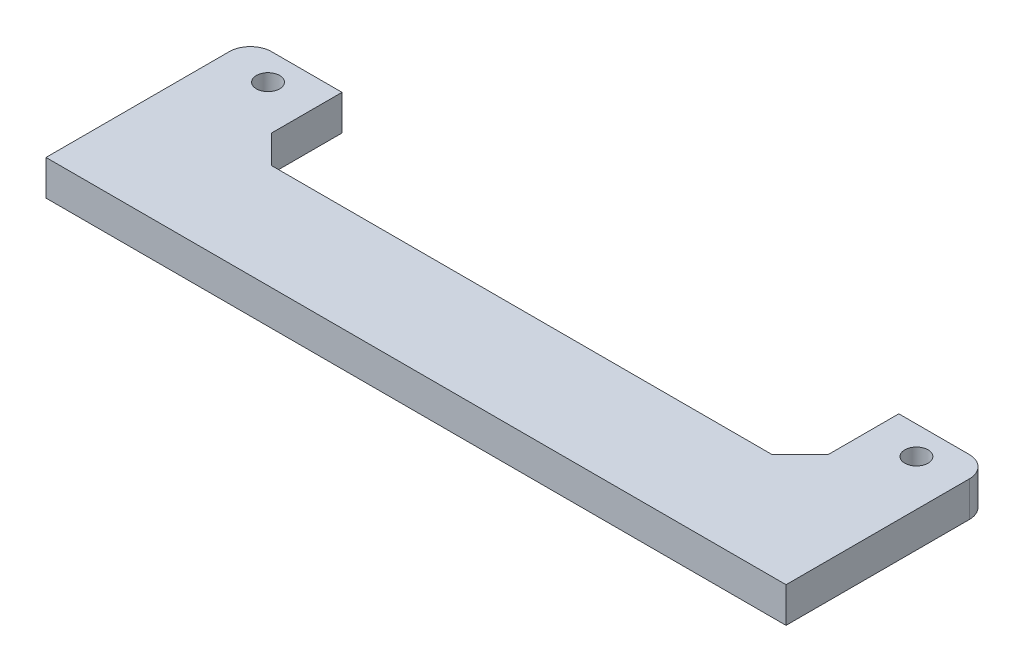
from build123d import *

# Parameters (mm, degrees)
SKETCH1_R           = 1.65
BOSS_EXTRUDE1_DEPTH = 5
CHAMFER1_SIZE       = 4
FILLET1_R           = 3


with BuildPart() as part:
    # Sketch1 → Boss-Extrude1 (new body)
    with BuildSketch(Plane(origin=(0, 0, 0), x_dir=(1, 0, 0), z_dir=(0, 1, 0))):
        Polygon((0, 0), (-52.5, 0), (-52.5, 29), (-39.5, 29), (-39.5, 15), (0, 15), align=None)
        with Locations(Location((-46, 25, 0), (0, 0, 270))):
            Circle(SKETCH1_R, mode=Mode.SUBTRACT)
    boss_extrude1 = extrude(amount=BOSS_EXTRUDE1_DEPTH)

    # Mirror1: Boss-Extrude1 across plane
    add(boss_extrude1.mirror(Plane(origin=(0, 0, 0), x_dir=(0, 0, 1), z_dir=(1, 0, 0))))

    # Chamfer1
    chamfer1_edges = [part.edges().sort_by_distance(p)[0] for p in [
        (-39.5, 2.5, -15),
        (39.5, 2.5, -15),
    ]]
    chamfer(chamfer1_edges, length=CHAMFER1_SIZE)

    # Fillet1
    fillet1_edges = [part.edges().sort_by_distance(p)[0] for p in [
        (-52.5, 2.5, -29),
        (52.5, 2.5, -29),
    ]]
    fillet(fillet1_edges, radius=FILLET1_R)


solid = part.part
